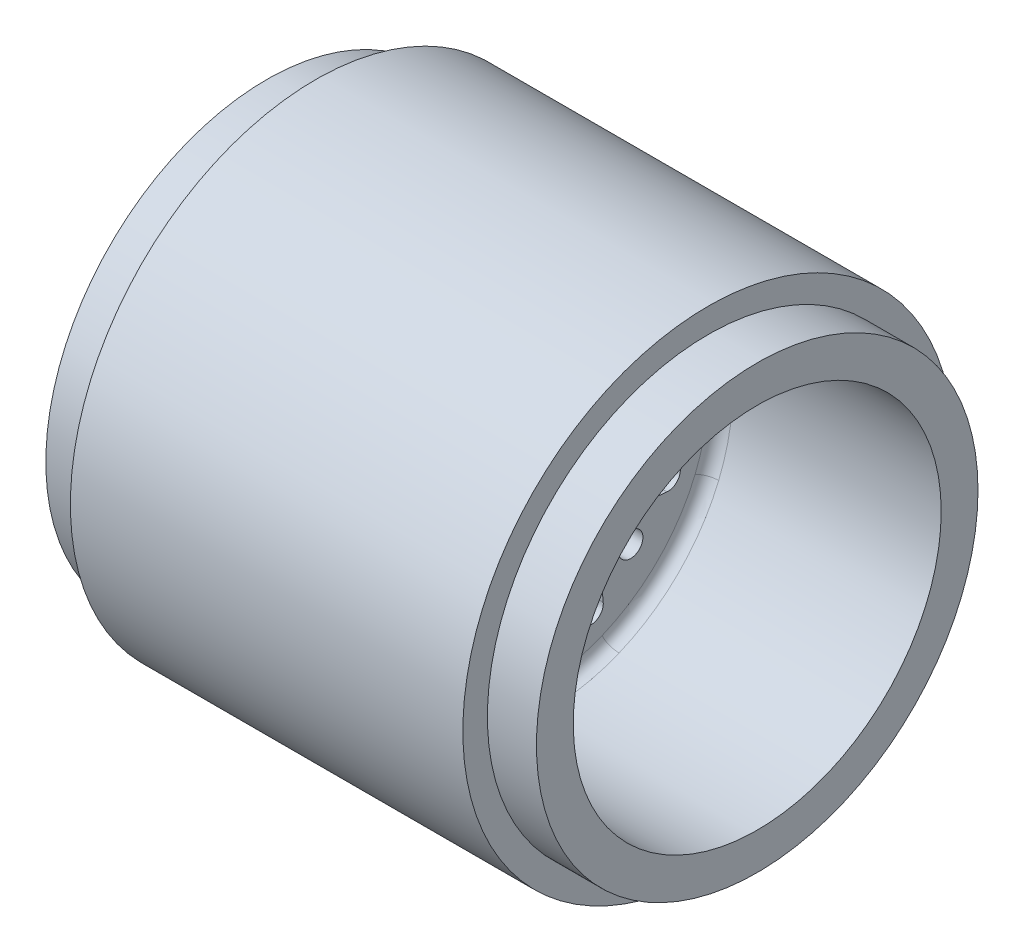
from build123d import *

# Parameters (mm, degrees)
CROQUIS1_R              = 100
SALIENTE_EXTRUIR1_DEPTH = 100
VACIADO1_T              = -25
CROQUIS2_R              = 5
SALIENTE_EXTRUIR3_DEPTH = 10
REDONDEO1_R             = 5
REDONDEO2_R             = 5
CROQUIS4_R              = 100
CROQUIS4_R_2            = 90
CORTAR_EXTRUIR1_DEPTH   = 20


with BuildPart() as part:
    # Croquis1 → Saliente-Extruir1 (new, symmetric)
    with BuildSketch(Plane(origin=(0, 0, 0), x_dir=(0, 0, -1), z_dir=(1, 0, 0))):
        Circle(CROQUIS1_R)
    extrude(amount=SALIENTE_EXTRUIR1_DEPTH, both=True)

    # Vaciado1
    vaciado1_openings = [part.faces().sort_by_distance(p)[0] for p in [
        (100, 0, 0),
        (-100, 0, 0),
    ]]
    offset(amount=VACIADO1_T, openings=vaciado1_openings, kind=Kind.INTERSECTION)

    # Croquis2 → Saliente-Extruir3 (add, symmetric)
    # profile 1 of 8: a face of its own
    with BuildSketch(Plane(origin=(0, 0, 0), x_dir=(0, 0, -1), z_dir=(1, 0, 0))):
        with BuildLine():
            ThreePointArc((-69.290964938, -28.701257427), (-53.033008589, -53.033008589), (-28.701257427, -69.290964938))
            Line((-28.701257427, -69.290964938), (-25.797262209, -38.728621904))
            ThreePointArc((-25.797262209, -38.728621904), (-29.457020709, -29.553384038), (-38.632258575, -25.893625538))
            Line((-38.632258575, -25.893625538), (-69.290964938, -28.701257427))
        make_face()
        with Locations((-38.302926542, -38.399289871)):
            Circle(CROQUIS2_R, mode=Mode.SUBTRACT)
    # profile 2 of 8: a face of its own
    with BuildSketch(Plane(origin=(0, 0, 0), x_dir=(0, 0, -1), z_dir=(1, 0, 0))):
        with BuildLine():
            Line((-9.007573804, -45.626690218), (-28.701257427, -69.290964938))
            ThreePointArc((-28.701257427, -69.290964938), (0, -75), (28.701257427, -69.290964938))
            Line((28.701257427, -69.290964938), (9.14385213, -45.626690218))
            ThreePointArc((9.14385213, -45.626690218), (0.068139163, -41.726657358), (-9.007573804, -45.626690218))
        make_face()
        with Locations((0.068139163, -54.236657358)):
            Circle(CROQUIS2_R, mode=Mode.SUBTRACT)
    # profile 3 of 8: a face of its own
    with BuildSketch(Plane(origin=(0, 0, 0), x_dir=(0, 0, -1), z_dir=(1, 0, 0))):
        with BuildLine():
            Line((25.893625537, -38.632258575), (28.701257427, -69.290964938))
            ThreePointArc((28.701257427, -69.290964938), (53.033008589, -53.033008589), (69.290964938, -28.701257427))
            Line((69.290964938, -28.701257427), (38.728621903, -25.797262209))
            ThreePointArc((38.728621903, -25.797262209), (29.553384038, -29.45702071), (25.893625537, -38.632258575))
        make_face()
        with Locations((38.39928987, -38.302926542)):
            Circle(CROQUIS2_R, mode=Mode.SUBTRACT)
    # profile 4 of 8: a face of its own
    with BuildSketch(Plane(origin=(0, 0, 0), x_dir=(0, 0, -1), z_dir=(1, 0, 0))):
        with BuildLine():
            ThreePointArc((-69.290964938, 28.701257427), (-75, 0), (-69.290964938, -28.701257428))
            Line((-69.290964938, -28.701257428), (-45.626690218, -9.14385213))
            ThreePointArc((-45.626690218, -9.14385213), (-41.726657357, -0.068139163), (-45.626690218, 9.007573804))
            Line((-45.626690218, 9.007573804), (-69.290964938, 28.701257427))
        make_face()
        with Locations((-54.236657357, -0.068139163)):
            Circle(CROQUIS2_R, mode=Mode.SUBTRACT)
    # profile 5 of 8: a face of its own
    with BuildSketch(Plane(origin=(0, 0, 0), x_dir=(0, 0, -1), z_dir=(1, 0, 0))):
        with BuildLine():
            Line((45.626690218, -9.007573804), (69.290964938, -28.701257428))
            ThreePointArc((69.290964938, -28.701257428), (75, 0), (69.290964938, 28.701257427))
            Line((69.290964938, 28.701257427), (45.626690218, 9.14385213))
            ThreePointArc((45.626690218, 9.14385213), (41.726657357, 0.068139163), (45.626690218, -9.007573804))
        make_face()
        with Locations((54.236657357, 0.068139163)):
            Circle(CROQUIS2_R, mode=Mode.SUBTRACT)
    # profile 6 of 8: a face of its own
    with BuildSketch(Plane(origin=(0, 0, 0), x_dir=(0, 0, -1), z_dir=(1, 0, 0))):
        with BuildLine():
            ThreePointArc((-28.701257427, 69.290964938), (-53.033008589, 53.033008589), (-69.290964938, 28.701257427))
            Line((-69.290964938, 28.701257427), (-38.728621903, 25.797262209))
            ThreePointArc((-38.728621903, 25.797262209), (-29.553384038, 29.457020709), (-25.893625537, 38.632258575))
            Line((-25.893625537, 38.632258575), (-28.701257427, 69.290964938))
        make_face()
        with Locations((-38.39928987, 38.302926542)):
            Circle(CROQUIS2_R, mode=Mode.SUBTRACT)
    # profile 7 of 8: a face of its own
    with BuildSketch(Plane(origin=(0, 0, 0), x_dir=(0, 0, -1), z_dir=(1, 0, 0))):
        with BuildLine():
            Line((38.632258575, 25.893625537), (69.290964938, 28.701257427))
            ThreePointArc((69.290964938, 28.701257427), (53.033008589, 53.033008589), (28.701257427, 69.290964938))
            Line((28.701257427, 69.290964938), (25.797262209, 38.728621903))
            ThreePointArc((25.797262209, 38.728621903), (29.457020709, 29.553384038), (38.632258575, 25.893625537))
        make_face()
        with Locations((38.302926542, 38.39928987)):
            Circle(CROQUIS2_R, mode=Mode.SUBTRACT)
    # profile 8 of 8: a face of its own
    with BuildSketch(Plane(origin=(0, 0, 0), x_dir=(0, 0, -1), z_dir=(1, 0, 0))):
        with BuildLine():
            ThreePointArc((28.701257427, 69.290964938), (0, 75), (-28.701257427, 69.290964938))
            Line((-28.701257427, 69.290964938), (-9.14385213, 45.626690218))
            ThreePointArc((-9.14385213, 45.626690218), (-0.068139163, 41.726657357), (9.007573804, 45.626690218))
            Line((9.007573804, 45.626690218), (28.701257427, 69.290964938))
        make_face()
        with Locations((-0.068139163, 54.236657357)):
            Circle(CROQUIS2_R, mode=Mode.SUBTRACT)
    extrude(amount=SALIENTE_EXTRUIR3_DEPTH, both=True)

    # Redondeo1
    redondeo1_edges = [part.edges().sort_by_distance(p)[0] for p in [
        (0, 69.290964938, 28.701257427),
        (0, 69.290964938, -28.701257427),
        (0, 28.701257427, -69.290964938),
        (0, -28.701257427, -69.290964938),
        (0, -69.290964938, -28.701257427),
        (0, -69.290964938, 28.701257427),
        (0, 28.701257427, 69.290964938),
        (0, -28.701257427, 69.290964938),
    ]]
    fillet(redondeo1_edges, radius=REDONDEO1_R)

    # Redondeo2
    redondeo2_edges = [part.edges().sort_by_distance(p)[0] for p in [
        (10, 75, 0),
        (-10, 75, 0),
        (10, 53.033008589, -53.033008589),
        (-10, 53.033008589, -53.033008589),
        (10, -6.62631001, -74.706706631),
        (-10, -6.62631001, -74.706706631),
        (10, -53.033008589, -53.033008589),
        (-10, -53.033008589, -53.033008589),
        (10, -75, 0),
        (-10, -75, 0),
        (10, -53.033008589, 53.033008589),
        (-10, -53.033008589, 53.033008589),
        (10, 0, 75),
        (-10, 0, 75),
        (10, 53.033008589, 53.033008589),
        (-10, 53.033008589, 53.033008589),
    ]]
    fillet(redondeo2_edges, radius=REDONDEO2_R)

    # Croquis4 → Cortar-Extruir1 (cut)
    with BuildSketch(Plane(origin=(100, 0, 0), x_dir=(0, 0, -1), z_dir=(1, 0, 0))):
        Circle(CROQUIS4_R)
        Circle(CROQUIS4_R_2, mode=Mode.SUBTRACT)
    cortar_extruir1 = extrude(amount=-CORTAR_EXTRUIR1_DEPTH, mode=Mode.SUBTRACT)

    # Simetría1: Cortar-Extruir1 across plane
    add(cortar_extruir1.mirror(Plane(origin=(0, 0, 0), x_dir=(0, 0, 1), z_dir=(1, 0, 0))), mode=Mode.SUBTRACT)


solid = part.part
